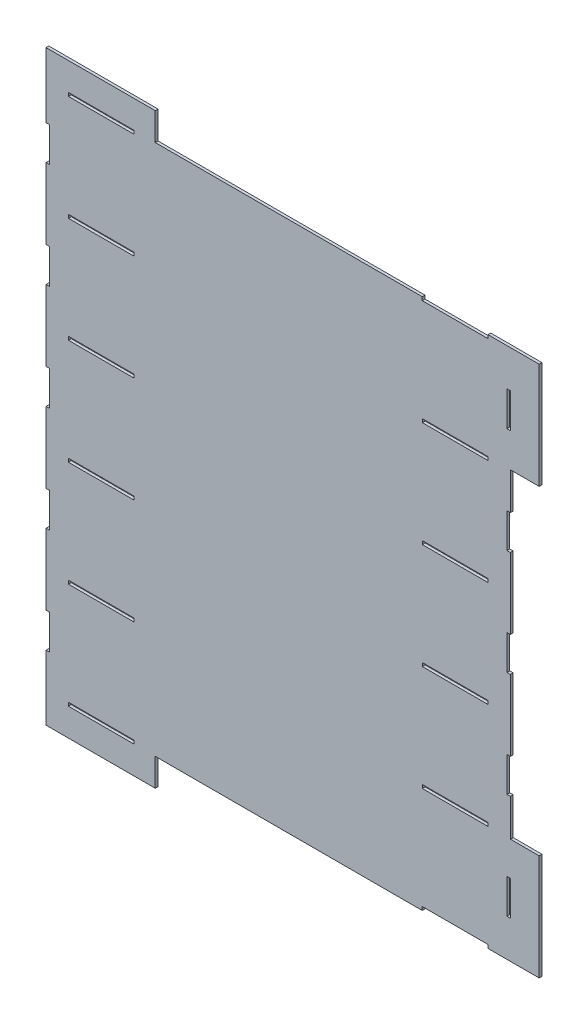
from build123d import *

# Parameters (mm, degrees)
SKETCH2_W               = 60.452
SKETCH2_H               = 3.175
BOSS_EXTRUDE3_DEPTH     = 2.54
CUT_EXTRUDE2_DEPTH      = 361.893602522
CUT_EXTRUDE2_DEPTH_BACK = 361.893602522
SKETCH4_W               = 60.325
SKETCH4_H               = 3.175
SKETCH4_W_2             = 3.175
SKETCH4_H_2             = 31.75


with BuildPart() as part:
    # Sketch2 → Boss-Extrude3 (new body)
    with BuildSketch(Plane.XY):
        Polygon((-213.36, -244.2845), (-213.36, -263.2075), (-213.36, -269.6845), (-113.03, -269.6845), (-113.03, -244.2845), (132.334, -244.2845), (132.334, -241.1095), (192.786, -241.1095), (192.786, -244.2845), (213.36, -244.2845), (239.808280092, -244.2845), (239.808280092, -147.0025), (213.36, -147.0025), (213.36, 147.0025), (239.808280092, 147.0025), (239.808280092, 244.2845), (213.36, 244.2845), (192.786, 244.2845), (192.786, 241.1095), (132.334, 241.1095), (132.334, 244.2845), (-113.03, 244.2845), (-113.03, 269.6845), (-213.36, 269.6845), (-213.36, 244.2845), align=None)
        with Locations((-162.56, -242.697)):
            Rectangle(SKETCH2_W, SKETCH2_H, mode=Mode.SUBTRACT)
        with Locations((-162.56, 242.697)):
            Rectangle(SKETCH2_W, SKETCH2_H, mode=Mode.SUBTRACT)
    extrude(amount=BOSS_EXTRUDE3_DEPTH)

    # Sketch4 → Cut-Extrude2 (cut, two sides: drawn at the far end of the back side and taken through both)
    with BuildSketch(Plane.XY.offset(2.54).offset(-CUT_EXTRUDE2_DEPTH_BACK)):
        with Locations((-162.6235, -145.542)):
            Rectangle(SKETCH4_W, SKETCH4_H)
        with Locations((-162.6235, -48.471666667)):
            Rectangle(SKETCH4_W, SKETCH4_H)
        with Locations((-162.6235, 48.598666667)):
            Rectangle(SKETCH4_W, SKETCH4_H)
        with Locations((-162.6235, 145.669)):
            Rectangle(SKETCH4_W, SKETCH4_H)
        with Locations((162.6235, -145.542)):
            Rectangle(SKETCH4_W, SKETCH4_H)
        with Locations((162.6235, -48.471666667)):
            Rectangle(SKETCH4_W, SKETCH4_H)
        with Locations((162.6235, 48.598666667)):
            Rectangle(SKETCH4_W, SKETCH4_H)
        with Locations((162.6235, 145.669)):
            Rectangle(SKETCH4_W, SKETCH4_H)
        with Locations((211.7725, -194.056)):
            Rectangle(SKETCH4_W_2, SKETCH4_H_2)
        with Locations((211.7725, -97.028)):
            Rectangle(SKETCH4_W_2, SKETCH4_H_2)
        with Locations((211.7725, 0)):
            Rectangle(SKETCH4_W_2, SKETCH4_H_2)
        with Locations((211.7725, 97.028)):
            Rectangle(SKETCH4_W_2, SKETCH4_H_2)
        with Locations((211.7725, 194.056)):
            Rectangle(SKETCH4_W_2, SKETCH4_H_2)
        with Locations((-211.7725, -97.028)):
            Rectangle(SKETCH4_W_2, SKETCH4_H_2)
        with Locations((-211.7725, 0)):
            Rectangle(SKETCH4_W_2, SKETCH4_H_2)
        with Locations((-211.7725, -194.056)):
            Rectangle(SKETCH4_W_2, SKETCH4_H_2)
        with Locations((-211.7725, 97.028)):
            Rectangle(SKETCH4_W_2, SKETCH4_H_2)
        with Locations((-211.7725, 194.056)):
            Rectangle(SKETCH4_W_2, SKETCH4_H_2)
    extrude(amount=CUT_EXTRUDE2_DEPTH + CUT_EXTRUDE2_DEPTH_BACK, mode=Mode.SUBTRACT)


solid = part.part
